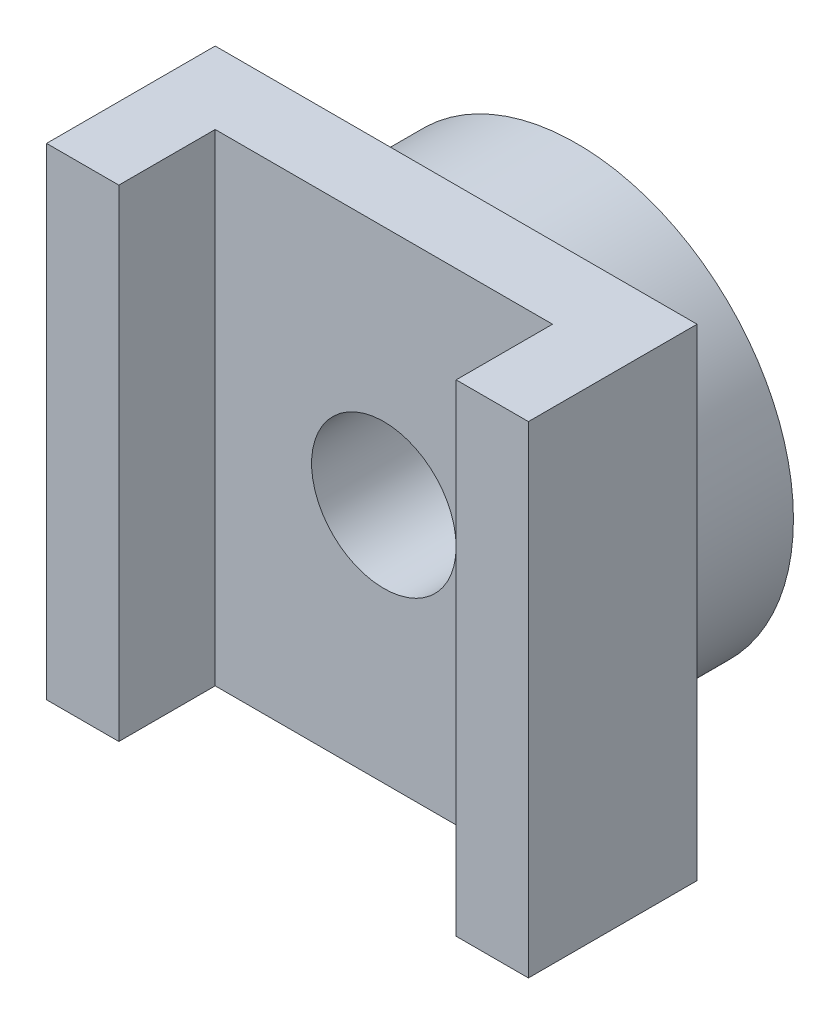
from build123d import *

# Parameters (mm, degrees)
SKETCH_1_R            = 4.5
EXTRUDE_1_DEPTH       = 2.5
SKETCH_2_W            = 10
SKETCH_2_H            = 10
EXTRUDE_2_DEPTH       = 1.5
SKETCH_3_W            = 1.5
SKETCH_3_H            = 10
EXTRUDE_3_DEPTH       = 2
HOLE_WIZARD_3_0_3_1_D = 3


with BuildPart() as part:
    # 草圖1 → 填料-伸長1 (new body)
    with BuildSketch(Plane.XY):
        Circle(SKETCH_1_R)
    extrude(amount=EXTRUDE_1_DEPTH)

    # 草圖2 → 填料-伸長2 (add)
    with BuildSketch(Plane.XY.offset(2.5)):
        Rectangle(SKETCH_2_W, SKETCH_2_H)
    extrude(amount=EXTRUDE_2_DEPTH)

    # 草圖3 → 填料-伸長3 (add)
    with BuildSketch(Plane.XY.offset(4)):
        with Locations((-4.25, 0)):
            Rectangle(SKETCH_3_W, SKETCH_3_H)
    extrude_3 = extrude(amount=EXTRUDE_3_DEPTH)

    # 鏡射1: 填料-伸長3 across plane
    add(extrude_3.mirror(Plane(origin=(0, 0, 0), x_dir=(0, 0, 1), z_dir=(1, 0, 0))))

    # Ø3.0 (3) 直徑孔1 (through all)
    with Locations(Plane.XY.offset(4)):
        with Locations((0, 0)):
            Hole(HOLE_WIZARD_3_0_3_1_D / 2)


solid = part.part
